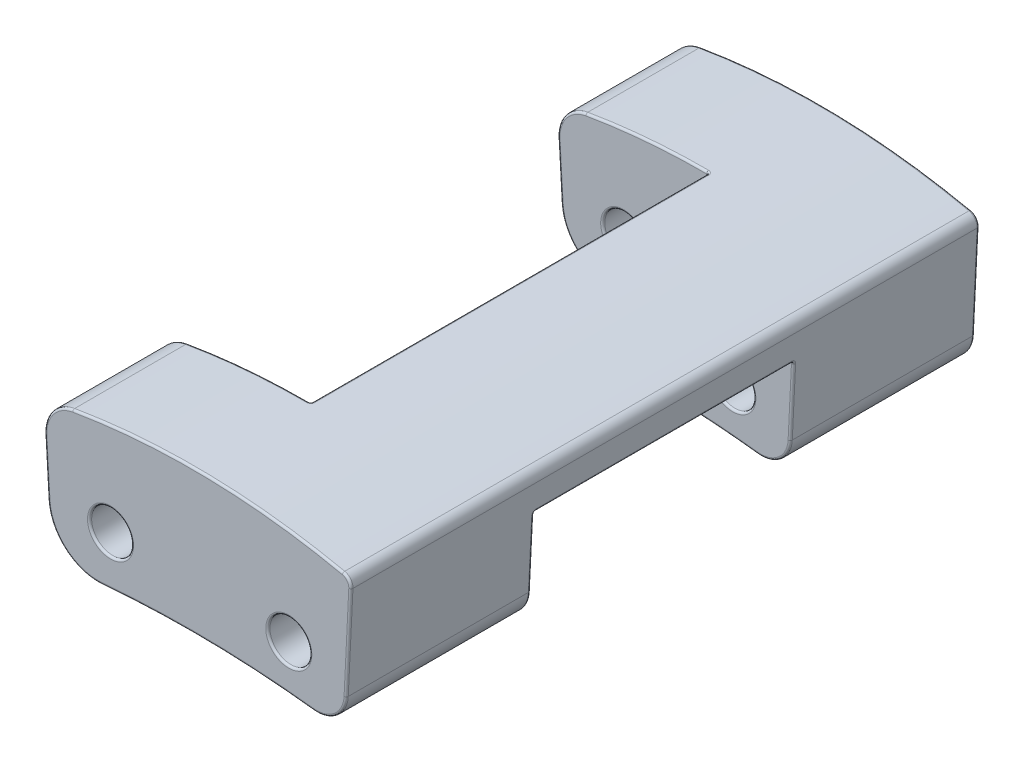
from build123d import *

# Parameters (mm, degrees)
SKETCH1_R               = 0.5
BOSS_EXTRUDE1_DEPTH     = 7.5
CUT_EXTRUDE1_DEPTH      = 15
SKETCH3_W               = 6.507782259
SKETCH3_H               = 9.5
CUT_EXTRUDE2_DEPTH      = 5
SKETCH4_W               = 15
SKETCH4_H               = 3.360747645
BOSS_EXTRUDE2_DEPTH     = 1.5
CUT_EXTRUDE3_DEPTH      = 16.644019284
BOSS_EXTRUDE3_DEPTH     = 15
SKETCH8_R               = 0.5
CUT_EXTRUDE4_DEPTH      = 16.644019284
FILLET1_R               = 0.25
FILLET2_R               = 0.7
CUT_EXTRUDE5_DEPTH      = 1
CUT_EXTRUDE5_DEPTH_BACK = 2
SKETCH9_W               = 7.495233053
SKETCH9_H               = 6.2
FILLET3_R               = 0.05


with BuildPart() as part:
    # Sketch1 → Boss-Extrude1 (new, symmetric)
    with BuildSketch(Plane.XY):
        with BuildLine():
            Line((3.214467516, 1.180191309), (3.139535455, -0.131119771))
            ThreePointArc((3.139535455, -0.131119771), (2.727253271, -0.969619698), (1.83856997, -1.258238334))
            ThreePointArc((1.83856997, -1.258238334), (-0.305594271, -1.166119811), (-2.449758512, -1.258238334))
            ThreePointArc((-2.449758512, -1.258238334), (-3.338441812, -0.969619698), (-3.750723996, -0.131119771))
            Line((-3.750723996, -0.131119771), (-3.825656058, 1.180191309))
            ThreePointArc((-3.825656058, 1.180191309), (-3.652789886, 1.724164053), (-3.161347372, 2.014462718))
            ThreePointArc((-3.161347372, 2.014462718), (-0.305594271, 2.256041723), (2.55015883, 2.014462718))
            ThreePointArc((2.55015883, 2.014462718), (3.041601344, 1.724164053), (3.214467516, 1.180191309))
        make_face()
        with Locations((-2.255594271, -0.070889968)):
            Circle(SKETCH1_R, mode=Mode.SUBTRACT)
    extrude(amount=BOSS_EXTRUDE1_DEPTH, both=True)

    # Sketch2 → Cut-Extrude1 (cut)
    with BuildSketch(Plane.XY.offset(7.5)):
        Polygon((1.83856997, -1.258238334), (2.048442209, 3.004085083), (6.043898684, 1.738990649), (3.82597996, -1.944195681), align=None)
    extrude(amount=-CUT_EXTRUDE1_DEPTH, mode=Mode.SUBTRACT)

    # Sketch3 → Cut-Extrude2 (cut, symmetric)
    with BuildSketch(Plane(origin=(0, 0, 0), x_dir=(1, 0, 0), z_dir=(0, 1, 0))):
        with Locations((-3.480850121, 0)):
            Rectangle(SKETCH3_W, SKETCH3_H)
    extrude(amount=CUT_EXTRUDE2_DEPTH, both=True, mode=Mode.SUBTRACT)

    # Sketch4 → Boss-Extrude2 (add)
    with BuildSketch(Plane(origin=(1.895927654, -0.093353447, 0), x_dir=(0, 0, -1), z_dir=(0.9987899637731681, -0.04917934796226596, 0))):
        with Locations((0, 0.514077676)):
            Rectangle(SKETCH4_W, SKETCH4_H)
    extrude(amount=BOSS_EXTRUDE2_DEPTH)

    # Sketch6 → Cut-Extrude3 (cut, through all)
    with BuildSketch(Plane.XY.offset(7.5)):
        with BuildLine():
            Line((-3.161347372, 2.014462718), (3.582877206, 4.079080063))
            Line((3.582877206, 4.079080063), (5.26786293, 2.202239529))
            Line((5.26786293, 2.202239529), (4.280334425, 1.625808307))
            ThreePointArc((4.280334425, 1.625808307), (0.58105107, 2.232904214), (-3.161347372, 2.014462718))
        make_face()
    extrude(amount=-CUT_EXTRUDE3_DEPTH, mode=Mode.SUBTRACT)

    # Sketch7 → Boss-Extrude3 (add)
    with BuildSketch(Plane.XY.offset(7.5)):
        with BuildLine():
            Line((3.378981184, -0.474428418), (3.336754915, -1.332007356))
            Line((3.336754915, -1.332007356), (3.331823925, -1.432151491))
            ThreePointArc((3.331823925, -1.432151491), (2.063975587, -1.27867039), (0.789943636, -1.190135412))
            Line((0.789943636, -1.190135412), (3.378981184, -0.474428418))
        make_face()
    extrude(amount=-BOSS_EXTRUDE3_DEPTH)

    # Sketch8 → Cut-Extrude4 (cut, through all)
    with BuildSketch(Plane.XY.offset(7.5)):
        with Locations((2, -0.2)):
            Circle(SKETCH8_R)
    extrude(amount=-CUT_EXTRUDE4_DEPTH, mode=Mode.SUBTRACT)

    # Fillet1
    fillet1_edges = [part.edges().sort_by_distance(p)[0] for p in [
        (3.492270691, 1.826383353, 0),
    ]]
    fillet(fillet1_edges, radius=FILLET1_R)

    # Fillet2
    fillet2_edges = [part.edges().sort_by_distance(p)[0] for p in [
        (3.331823925, -1.432151491, 0),
    ]]
    fillet(fillet2_edges, radius=FILLET2_R)

    # Sketch9 → Cut-Extrude5 (cut, two sides: drawn at the far end of the back side and taken through both)
    with BuildSketch(Plane(origin=(0, 0, 0), x_dir=(1, 0, 0), z_dir=(0, 1, 0)).offset(-CUT_EXTRUDE5_DEPTH_BACK)):
        with Locations((4.882888726, 0)):
            Rectangle(SKETCH9_W, SKETCH9_H)
    extrude(amount=CUT_EXTRUDE5_DEPTH + CUT_EXTRUDE5_DEPTH_BACK, mode=Mode.SUBTRACT)

    # Fillet3
    fillet3_edges = [part.edges().sort_by_distance(p)[0] for p in [
        (-3.788190027, 0.524535769, 7.5),
        (-3.652789886, 1.724164053, -7.5),
        (1.5, -0.2, -7.5),
        (1.5, -0.2, 7.5),
        (-3.338441812, -0.969619698, 7.5),
        (0.068622726, 2.251922449, 7.5),
        (0.068622726, 2.251922449, -7.5),
        (3.430562477, 1.780335166, -7.5),
        (3.42554491, 0.471240536, 7.5),
        (3.430562477, 1.780335166, 7.5),
        (3.122468898, -1.17309987, 7.5),
        (3.42554491, 0.471240536, -7.5),
        (3.122468898, -1.17309987, -7.5),
        (3.122468898, -1.17309987, -3.1),
        (3.122468898, -1.17309987, 3.1),
        (3.45158046, 1, 0),
        (1.135272199, -1.207676274, 0),
        (1.135272199, -0.103838137, -3.1),
        (3.41038249, 0.163304907, 3.1),
        (1.135272199, -0.103838137, 3.1),
        (1.5, -0.2, 3.1),
        (3.41038249, 0.163304907, -3.1),
        (1.5, -0.2, -3.1),
        (1.86305152, -1.260357919, 3.1),
        (1.86305152, -1.260357919, -3.1),
        (2.293426329, 1, -3.1),
        (1.135272199, 1, 0),
        (2.293426329, 1, 3.1),
        (0.071532724, -1.168964469, 7.5),
        (-2.755594271, -0.070889968, -7.5),
        (-2.755594271, -0.070889968, 7.5),
        (-0.226958991, -1.166243482, 0),
        (-0.226958991, 0.544808186, -4.75),
        (-0.226958991, 2.255859854, 0),
        (-3.652789886, 1.724164053, -4.75),
        (-1.699389088, 2.198808204, -4.75),
        (-1.339382564, -1.187503321, -4.75),
        (-3.338441812, -0.969619698, -4.75),
        (-3.788190027, 0.524535769, -4.75),
        (-2.755594271, -0.070889968, -4.75),
        (-0.226958991, 0.544808186, 4.75),
        (-1.699389088, 2.198808204, 4.75),
        (-3.652789886, 1.724164053, 4.75),
        (-3.788190027, 0.524535769, 4.75),
        (-3.338441812, -0.969619698, 4.75),
        (-1.339382564, -1.187503321, 4.75),
        (-2.755594271, -0.070889968, 4.75),
        (-3.652789886, 1.724164053, 7.5),
        (0.071532724, -1.168964469, -7.5),
        (-3.338441812, -0.969619698, -7.5),
        (-3.788190027, 0.524535769, -7.5),
    ]]
    fillet(fillet3_edges, radius=FILLET3_R)


solid = part.part
